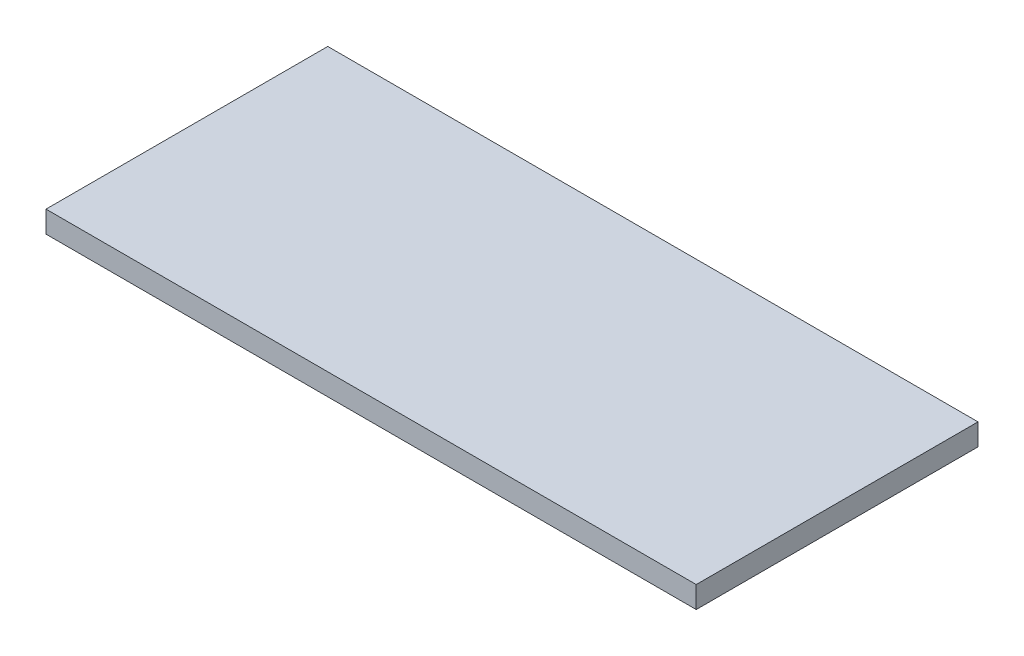
from build123d import *

# Parameters (mm, degrees)
SKETCH2_W           = 1500
SKETCH2_H           = 650
BOSS_EXTRUDE2_DEPTH = 50


with BuildPart() as part:
    # Sketch2 → Boss-Extrude2 (new body)
    with BuildSketch(Plane(origin=(0, 0, 0), x_dir=(1, 0, 0), z_dir=(0, 1, 0))):
        Rectangle(SKETCH2_W, SKETCH2_H)
    extrude(amount=BOSS_EXTRUDE2_DEPTH)


solid = part.part
